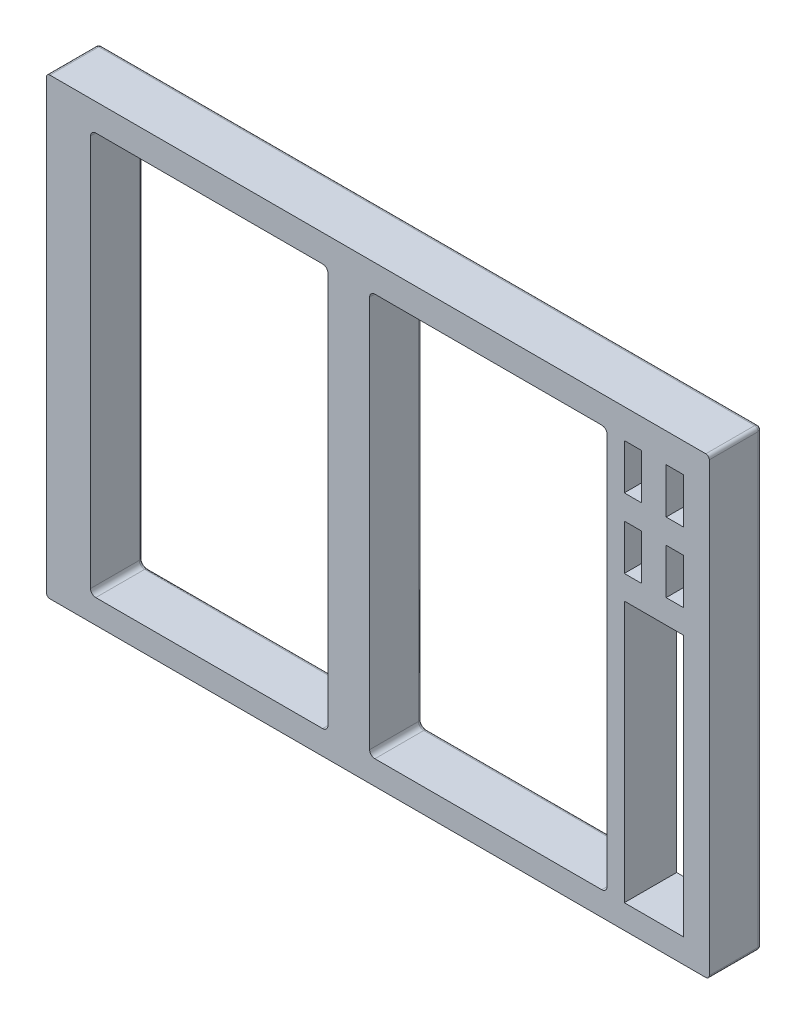
from build123d import *

# Parameters (mm, degrees)
ESQUISSE2_W        = 190
ESQUISSE2_H        = 130
ESQUISSE2_W_2      = 5
ESQUISSE2_H_2      = 13
ESQUISSE2_W_3      = 17
ESQUISSE2_H_3      = 74.885911828
BOSS_EXTRU_1_DEPTH = 15
CONG_1_R           = 1


with BuildPart() as part:
    # Esquisse2 → Boss.-Extru.1 (new body)
    with BuildSketch(Plane.XY):
        with Locations((229.947995903, -105.556817115)):
            Rectangle(ESQUISSE2_W, ESQUISSE2_H)
        with BuildLine():
            Line((294.126931092, -163.674733602), (229.09264334, -163.674733602))
            ThreePointArc((229.09264334, -163.674733602), (228.031983168, -163.235393774), (227.59264334, -162.174733602))
            Line((227.59264334, -162.174733602), (227.59264334, -49.858733602))
            ThreePointArc((227.59264334, -49.858733602), (228.031983168, -48.79807343), (229.09264334, -48.358733602))
            Line((229.09264334, -48.358733602), (294.126931092, -48.358733602))
            ThreePointArc((294.126931092, -48.358733602), (295.187591264, -48.79807343), (295.626931092, -49.858733602))
            Line((295.626931092, -49.858733602), (295.626931092, -162.174733602))
            ThreePointArc((295.626931092, -162.174733602), (295.187591264, -163.235393774), (294.126931092, -163.674733602))
        make_face(mode=Mode.SUBTRACT)
        with BuildLine():
            Line((214.126931092, -163.674733602), (149.09264334, -163.674733602))
            ThreePointArc((149.09264334, -163.674733602), (148.031983168, -163.235393774), (147.59264334, -162.174733602))
            Line((147.59264334, -162.174733602), (147.59264334, -49.858733602))
            ThreePointArc((147.59264334, -49.858733602), (148.031983168, -48.79807343), (149.09264334, -48.358733602))
            Line((149.09264334, -48.358733602), (214.126931092, -48.358733602))
            ThreePointArc((214.126931092, -48.358733602), (215.187591264, -48.79807343), (215.626931092, -49.858733602))
            Line((215.626931092, -49.858733602), (215.626931092, -162.174733602))
            ThreePointArc((215.626931092, -162.174733602), (215.187591264, -163.235393774), (214.126931092, -163.674733602))
        make_face(mode=Mode.SUBTRACT)
        with Locations((315.079916598, -55.443215784)):
            Rectangle(ESQUISSE2_W_2, ESQUISSE2_H_2, mode=Mode.SUBTRACT)
        with Locations((303.079916598, -55.443215784)):
            Rectangle(ESQUISSE2_W_2, ESQUISSE2_H_2, mode=Mode.SUBTRACT)
        with Locations((315.079916598, -75.443215784)):
            Rectangle(ESQUISSE2_W_2, ESQUISSE2_H_2, mode=Mode.SUBTRACT)
        with Locations((303.079916598, -75.443215784)):
            Rectangle(ESQUISSE2_W_2, ESQUISSE2_H_2, mode=Mode.SUBTRACT)
        with Locations((309.079916598, -126.231777688)):
            Rectangle(ESQUISSE2_W_3, ESQUISSE2_H_3, mode=Mode.SUBTRACT)
    extrude(amount=BOSS_EXTRU_1_DEPTH)

    # Congé1
    cong_1_edges = [part.edges().sort_by_distance(p)[0] for p in [
        (295.187591264, -163.235393774, 0),
        (295.626931092, -106.016733602, 0),
        (295.187591264, -48.79807343, 0),
        (261.609787216, -48.358733602, 0),
        (228.031983168, -48.79807343, 0),
        (227.59264334, -106.016733602, 0),
        (228.031983168, -163.235393774, 0),
        (261.609787216, -163.674733602, 0),
        (305.579916598, -75.443215784, 0),
        (303.079916598, -68.943215784, 0),
        (300.579916598, -75.443215784, 0),
        (303.079916598, -81.943215784, 0),
        (317.579916598, -75.443215784, 0),
        (315.079916598, -68.943215784, 0),
        (312.579916598, -75.443215784, 0),
        (315.079916598, -81.943215784, 0),
        (134.947995903, -105.556817115, 0),
        (229.947995903, -40.556817115, 0),
        (324.947995903, -105.556817115, 0),
        (229.947995903, -170.556817115, 0),
        (215.187591264, -163.235393774, 0),
        (215.626931092, -106.016733602, 0),
        (215.187591264, -48.79807343, 0),
        (181.609787216, -48.358733602, 0),
        (148.031983168, -48.79807343, 0),
        (147.59264334, -106.016733602, 0),
        (148.031983168, -163.235393774, 0),
        (181.609787216, -163.674733602, 0),
        (134.947995903, -170.556817115, 7.5),
        (134.947995903, -40.556817115, 7.5),
        (324.947995903, -40.556817115, 7.5),
        (324.947995903, -170.556817115, 7.5),
    ]]
    fillet(cong_1_edges, radius=CONG_1_R)


solid = part.part
